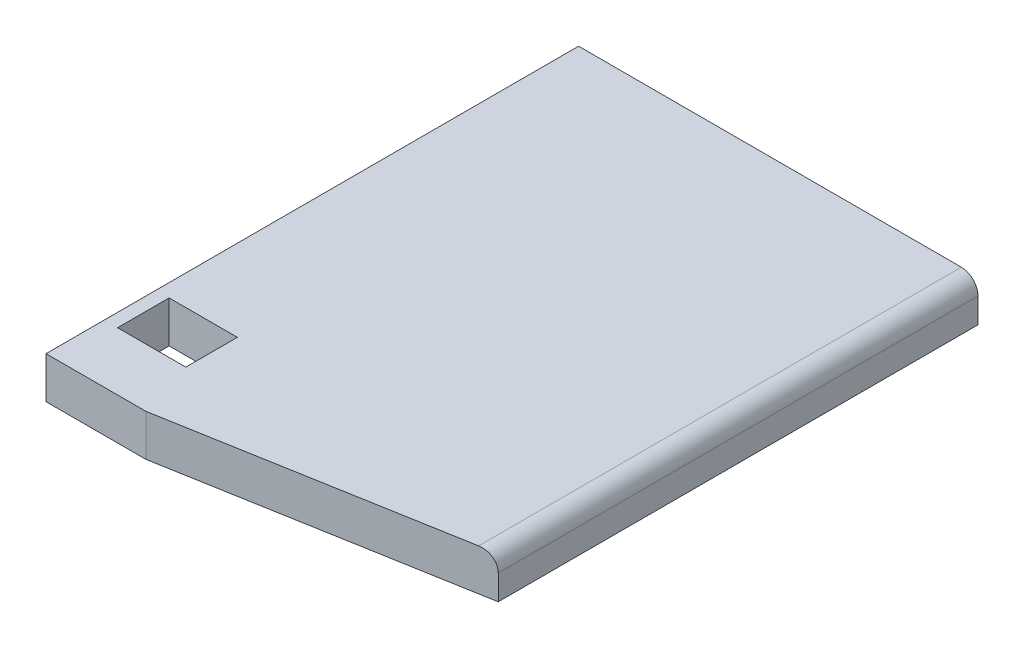
from build123d import *

# Parameters (mm, degrees)
SKETCH_3_W          = 2.5
SKETCH_3_H          = 24
EXTRUDE_1_DEPTH     = 33
FILLET_1_R          = 1
CUT_EXTRUDE_1_DEPTH = 41.880924647
SKETCH_5_W          = 2.5
SKETCH_5_H          = 3.1
CUT_EXTRUDE_2_DEPTH = 4.9
SKETCH_6_W          = 24
SKETCH_6_H          = 2.5
CUT_EXTRUDE_3_DEPTH = 1
CUT_EXTRUDE_4_DEPTH = 41.078048855
SKETCH_8_W          = 0.8
SKETCH_8_H          = 3.1
EXTRUDE_2_DEPTH     = 2.5


with BuildPart() as part:
    # 草图3 → 凸台-拉伸1 (new body)
    with BuildSketch(Plane(origin=(0, 0, 0), x_dir=(0, 1, 0), z_dir=(0, 0, 1))):
        with Locations((1.25, -12)):
            Rectangle(SKETCH_3_W, SKETCH_3_H)
    extrude(amount=EXTRUDE_1_DEPTH)

    # 圆角1
    fillet_1_edges = [part.edges().sort_by_distance(p)[0] for p in [
        (24, 2.5, 16.5),
    ]]
    fillet(fillet_1_edges, radius=FILLET_1_R)

    # 草图4 → 切除-拉伸1 (cut, through all)
    with BuildSketch(Plane.XZ):
        Polygon((3, 33), (24, 31.162738066), (24, 33), align=None)
    extrude(amount=-CUT_EXTRUDE_1_DEPTH, mode=Mode.SUBTRACT)

    # 草图5 → 切除-拉伸2 (cut)
    with BuildSketch(Plane(origin=(0, 0, 0), x_dir=(0, -1, 0), z_dir=(-1, 0, 0))):
        with Locations((-1.25, 26.95)):
            Rectangle(SKETCH_5_W, SKETCH_5_H)
    extrude(amount=-CUT_EXTRUDE_2_DEPTH, mode=Mode.SUBTRACT)

    # 草图6 → 切除-拉伸3 (cut)
    with BuildSketch(Plane.XY.offset(33)):
        with Locations((12, 1.25)):
            Rectangle(SKETCH_6_W, SKETCH_6_H)
    extrude(amount=-CUT_EXTRUDE_3_DEPTH, mode=Mode.SUBTRACT)

    # 草图7 → 切除-拉伸4 (cut, through all)
    with BuildSketch(Plane.XZ):
        Polygon((24, 31.162738066), (24, 28.826114347), (6, 32), (14.430052303, 32), align=None)
    extrude(amount=-CUT_EXTRUDE_4_DEPTH, mode=Mode.SUBTRACT)

    # 草图8 → 凸台-拉伸2 (add)
    with BuildSketch(Plane(origin=(0, 2.5, 0), x_dir=(-1, 0, 0), z_dir=(0, 1, 0))):
        with Locations((-0.4, 26.95)):
            Rectangle(SKETCH_8_W, SKETCH_8_H)
    extrude(amount=-EXTRUDE_2_DEPTH)


solid = part.part
